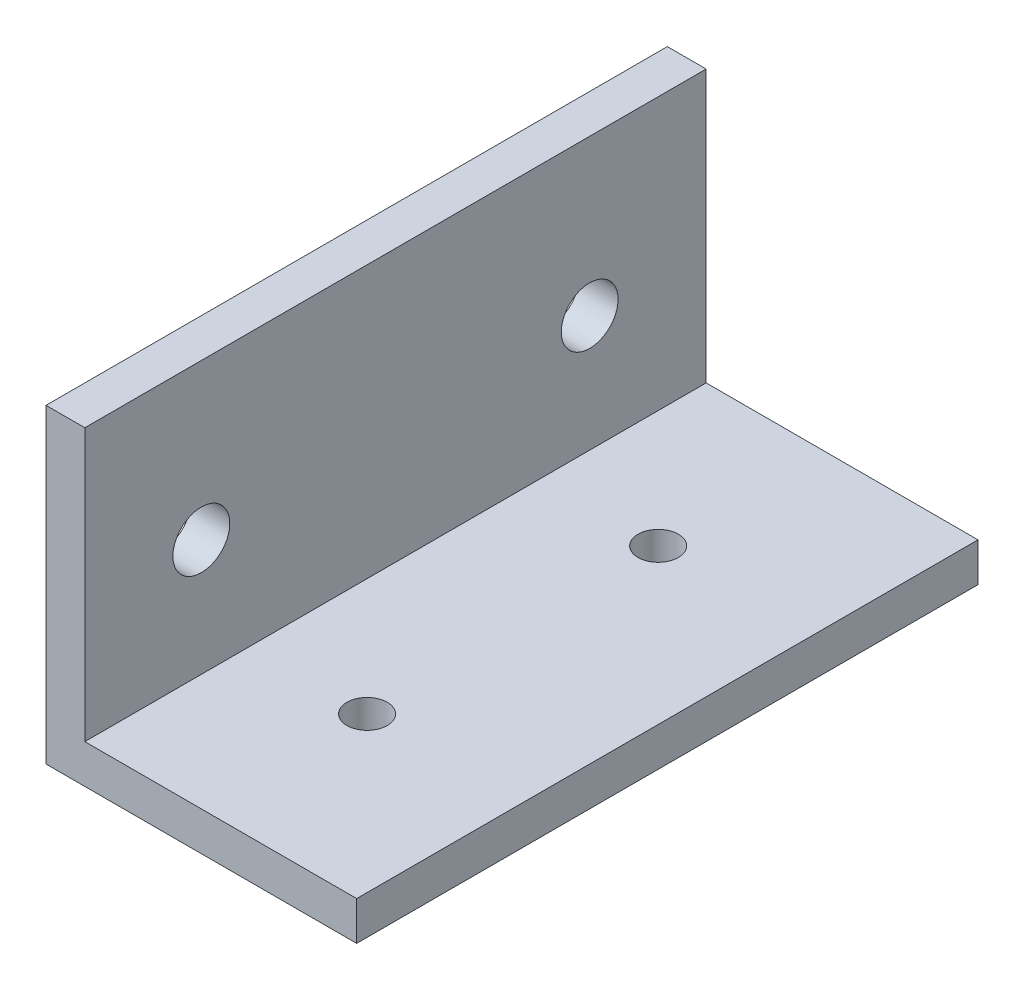
from build123d import *

# Parameters (mm, degrees)
BOSS_EXTRUDE1_DEPTH = 50.8
SKETCH2_R           = 1.65
CUT_EXTRUDE1_DEPTH  = 61.989758362
SKETCH3_R           = 2.3241
CUT_EXTRUDE2_DEPTH  = 63.217039467


with BuildPart() as part:
    # Sketch1 → Boss-Extrude1 (new body)
    with BuildSketch(Plane.XY):
        Polygon((0, 25.4), (0, 0), (25.4, 0), (25.4, 3.175), (3.175, 3.175), (3.175, 25.4), align=None)
    extrude(amount=BOSS_EXTRUDE1_DEPTH)

    # Sketch2 → Cut-Extrude1 (cut, through all)
    with BuildSketch(Plane(origin=(0, 3.175, 0), x_dir=(1, 0, 0), z_dir=(0, 1, 0))):
        with Locations(Location((12.75, -13.499999988, 0), (0, 0, 270))):
            Circle(SKETCH2_R)
        with Locations(Location((12.75, -37.299999988, 0), (0, 0, 270))):
            Circle(SKETCH2_R)
    extrude(amount=-CUT_EXTRUDE1_DEPTH, mode=Mode.SUBTRACT)

    # Sketch3 → Cut-Extrude2 (cut, through all)
    with BuildSketch(Plane.ZY):
        with Locations((9.525, 12.7)):
            Circle(SKETCH3_R)
        with Locations((41.275, 12.7)):
            Circle(SKETCH3_R)
    extrude(amount=-CUT_EXTRUDE2_DEPTH, mode=Mode.SUBTRACT)


solid = part.part
